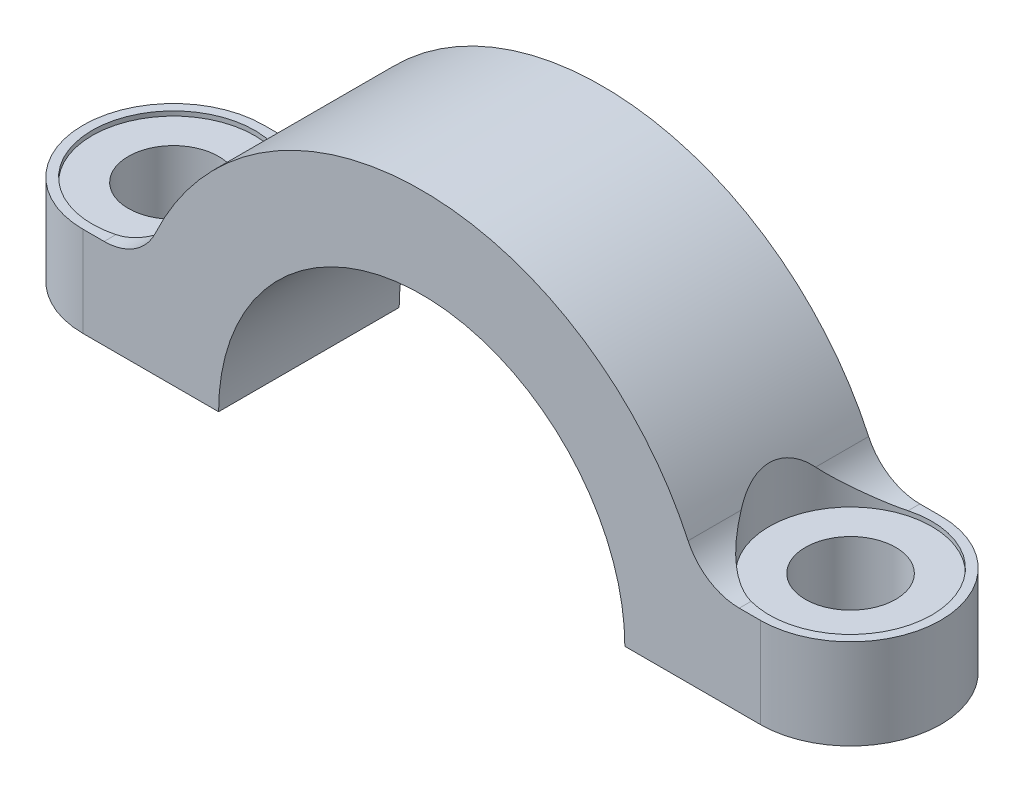
from build123d import *

# Parameters (mm, degrees)
BOSS_EXTRUDE1_DEPTH = 4
SKETCH2_R           = 2
CUT_EXTRUDE2_DEPTH  = 8
FILLET2_RADIUS      = 4
FILLET2_LENGTH      = 4
FILLET3_RADIUS      = 4
FILLET3_LENGTH      = 4
CUT_EXTRUDE3_START  = 3.8
SKETCH3_R           = 3.6
CUT_EXTRUDE3_DEPTH  = 8


with BuildPart() as part:
    # Sketch1 → Boss-Extrude1 (new, symmetric)
    with BuildSketch(Plane.XY):
        with BuildLine():
            Line((-19, 0), (-9, 0))
            ThreePointArc((-9, 0), (0, 9), (9, 0))
            Line((9, 0), (19, 0))
            Line((19, 0), (19, 4))
            Line((19, 4), (14.071247279, 4))
            ThreePointArc((14.071247279, 4), (12.724207514, 4.393941152), (11.801691267, 5.451612903))
            ThreePointArc((11.801691267, 5.451612903), (0, 13), (-11.801691267, 5.451612903))
            ThreePointArc((-11.801691267, 5.451612903), (-12.724207514, 4.393941152), (-14.071247279, 4))
            Line((-14.071247279, 4), (-19, 4))
            Line((-19, 4), (-19, 0))
        make_face()
    extrude(amount=BOSS_EXTRUDE1_DEPTH, both=True)

    # Sketch2 → Cut-Extrude2 (cut)
    with BuildSketch(Plane(origin=(0, 0, 0), x_dir=(1, 0, 0), z_dir=(0, 1, 0))):
        with Locations(Location((-15, 0, 0), (0, 0, 62.330131378))):
            Circle(SKETCH2_R)
        with Locations(Location((15, 0, 0), (0, 0, 117.669868622))):
            Circle(SKETCH2_R)
    extrude(amount=CUT_EXTRUDE2_DEPTH, mode=Mode.SUBTRACT)

    # Fillet2: full round fillet: the end face becomes a half cylinder, R = half its width
    fillet2_face = Plane((19, 2, 0), x_dir=(0, 1, 0), z_dir=(1, 0, 0))  # on the end face: x along it, z out of the body
    fillet2_slab = fillet2_face.offset(-FILLET2_RADIUS / 2) * Box(FILLET2_LENGTH, 2 * FILLET2_RADIUS, FILLET2_RADIUS, mode=Mode.PRIVATE)  # the body's end, R deep
    fillet2_round = Plane((15, 2, 0), x_dir=(1, 0, 0), z_dir=(0, 1, 0)) * Cylinder(FILLET2_RADIUS, FILLET2_LENGTH, mode=Mode.PRIVATE)  # its axis R under the face
    add(fillet2_slab - fillet2_round, mode=Mode.SUBTRACT)

    # Fillet3: full round fillet: the end face becomes a half cylinder, R = half its width
    fillet3_face = Plane((-19, 2, 0), x_dir=(0, -1, 0), z_dir=(-1, 0, 0))  # on the end face: x along it, z out of the body
    fillet3_slab = fillet3_face.offset(-FILLET3_RADIUS / 2) * Box(FILLET3_LENGTH, 2 * FILLET3_RADIUS, FILLET3_RADIUS, mode=Mode.PRIVATE)  # the body's end, R deep
    fillet3_round = Plane((-15, 2, 0), x_dir=(-1, 0, 0), z_dir=(0, -1, 0)) * Cylinder(FILLET3_RADIUS, FILLET3_LENGTH, mode=Mode.PRIVATE)  # its axis R under the face
    add(fillet3_slab - fillet3_round, mode=Mode.SUBTRACT)

    # Sketch3 → Cut-Extrude3 (cut)
    with BuildSketch(Plane(origin=(0, 0, 0), x_dir=(1, 0, 0), z_dir=(0, 1, 0)).offset(CUT_EXTRUDE3_START)):
        with Locations(Location((-15, 0, 0), (0, 0, 75.049356593))):
            Circle(SKETCH3_R)
        with Locations(Location((15, 0, 0), (0, 0, 104.950643407))):
            Circle(SKETCH3_R)
    extrude(amount=CUT_EXTRUDE3_DEPTH, mode=Mode.SUBTRACT)


solid = part.part
